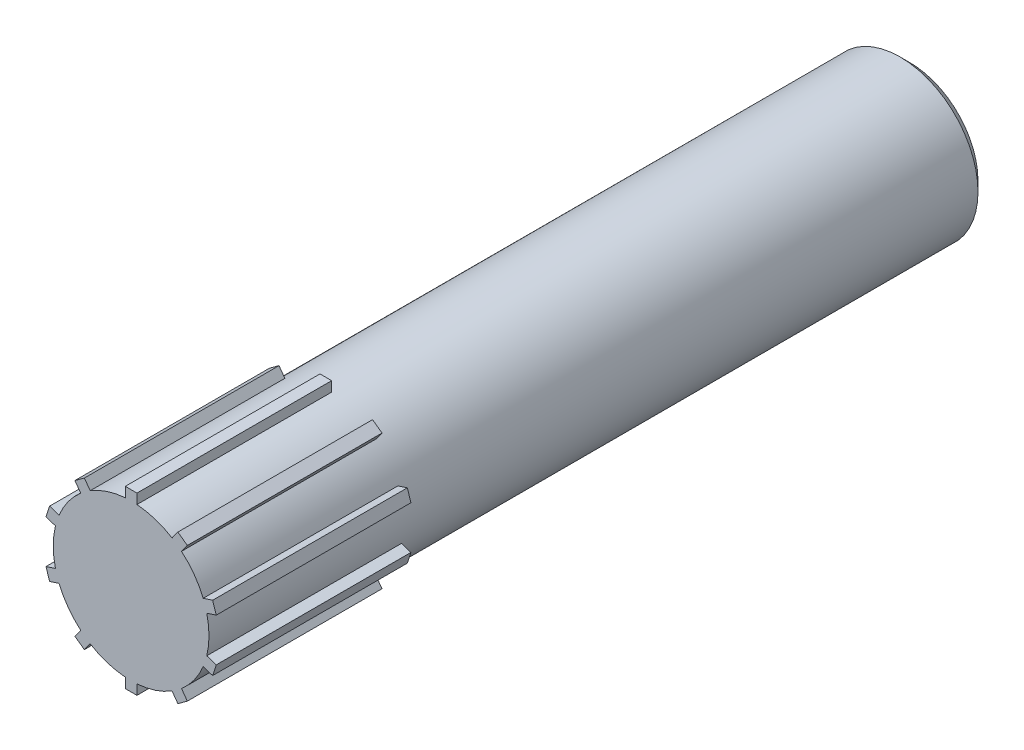
from build123d import *

# Parameters (mm, degrees)
SKETCH1_R           = 4
BOSS_EXTRUDE1_DEPTH = 40
CUT_EXTRUDE1_START  = -2.5
CUT_EXTRUDE1_DEPTH  = 38.898019753
SKETCH3_W           = 0.6
SKETCH3_H           = 2.503909158
BOSS_EXTRUDE2_DEPTH = 10
CIRPATTERN1_COUNT   = 10
CHAMFER1_SIZE       = 0.5


with BuildPart() as part:
    # Sketch1 → Boss-Extrude1 (new body)
    with BuildSketch(Plane.XY):
        Circle(SKETCH1_R)
    extrude(amount=BOSS_EXTRUDE1_DEPTH)

    # Sketch2 → Cut-Extrude1 (cut, through all)
    with BuildSketch(Plane(origin=(0, 0, 0), x_dir=(1, 0, 0), z_dir=(0, 1, 0)).offset(CUT_EXTRUDE1_START)):
        with BuildLine():
            Line((1.5, -5), (1.5, -9))
            ThreePointArc((1.5, -9), (0, -10.5), (-1.5, -9))
            Line((-1.5, -9), (-1.5, -5))
            ThreePointArc((-1.5, -5), (0, -3.5), (1.5, -5))
        make_face()
    extrude(amount=-CUT_EXTRUDE1_DEPTH, mode=Mode.SUBTRACT)

    # Sketch3 → Boss-Extrude2 (add)
    with BuildSketch(Plane.XY.offset(40)):
        with Locations((0, 3.248045421)):
            Rectangle(SKETCH3_W, SKETCH3_H)
    boss_extrude2 = extrude(amount=-BOSS_EXTRUDE2_DEPTH)

    # CirPattern1: Boss-Extrude2 ×10 about axis
    cirpattern1_axis = Axis((0, 0, 0), (0, 0, 1))
    for i in range(1, CIRPATTERN1_COUNT):
        add(boss_extrude2.rotate(cirpattern1_axis, i * 360 / CIRPATTERN1_COUNT))

    # Chamfer1
    chamfer1_edges = [part.edges().sort_by_distance(p)[0] for p in [
        (-4, 0, 0),
    ]]
    chamfer(chamfer1_edges, length=CHAMFER1_SIZE)


solid = part.part
